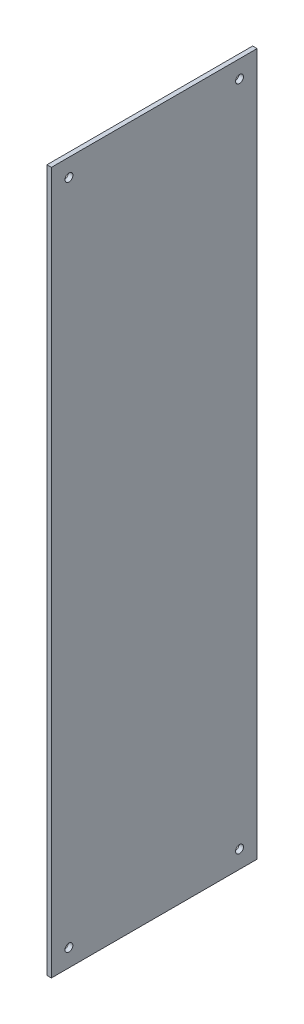
from build123d import *

# Parameters (mm, degrees)
SKETCH1_W           = 500
SKETCH1_H           = 146.5
SKETCH1_R           = 2.8
BOSS_EXTRUDE1_DEPTH = 3.175


with BuildPart() as part:
    # Sketch1 → Boss-Extrude1 (new body)
    with BuildSketch(Plane.YZ):
        Rectangle(SKETCH1_W, SKETCH1_H)
        with Locations(Location((-237.5, 60.75, 0), (0, 0, 270))):
            Circle(SKETCH1_R, mode=Mode.SUBTRACT)
        with Locations(Location((-237.5, -60.75, 0), (0, 0, 270))):
            Circle(SKETCH1_R, mode=Mode.SUBTRACT)
        with Locations(Location((237.5, 60.75, 0), (0, 0, 270))):
            Circle(SKETCH1_R, mode=Mode.SUBTRACT)
        with Locations(Location((237.5, -60.75, 0), (0, 0, 270))):
            Circle(SKETCH1_R, mode=Mode.SUBTRACT)
    extrude(amount=BOSS_EXTRUDE1_DEPTH)


solid = part.part
